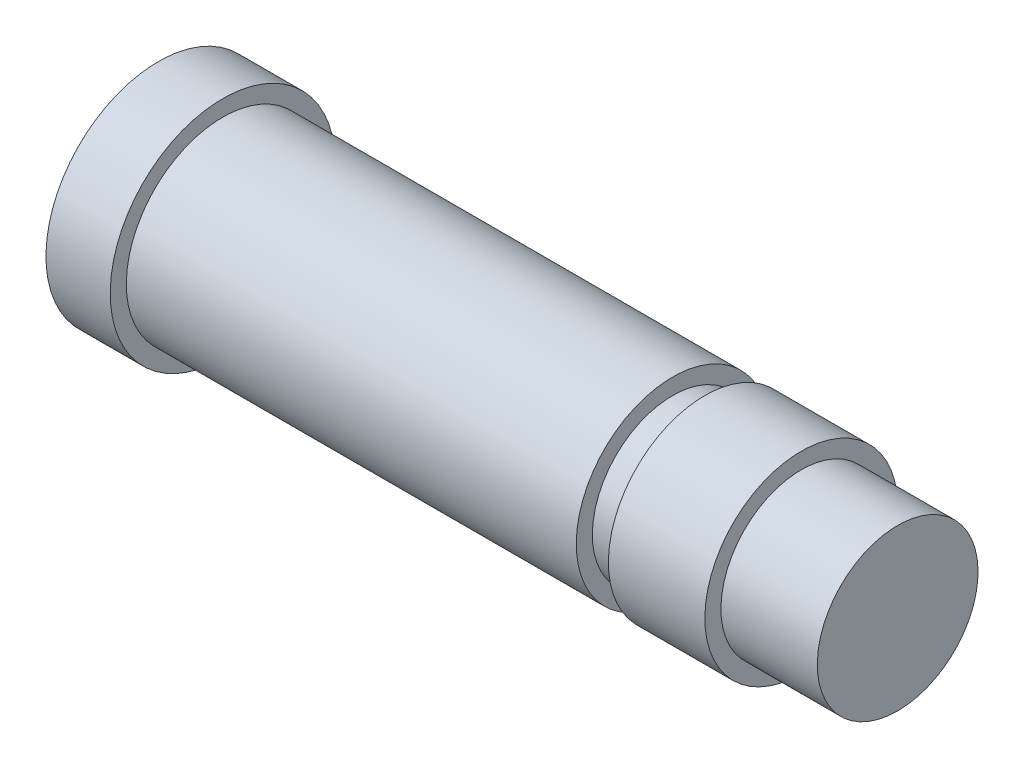
from build123d import *


with BuildPart() as part:
    # Sketch1 → Revolve1 (revolve)
    with BuildSketch(Plane.XY, mode=Mode.PRIVATE) as revolve1_sk:
        Polygon((0, 0), (40, 0), (46, 0), (46, 5), (40, 5), (40, 6), (34, 6), (34, 5), (32, 5), (32, 6), (4, 6), (4, 7), (0, 7), align=None)
    revolve(revolve1_sk.sketch.rotate(Axis((0, 0, 0), (1, 0, 0)), 180), axis=Axis((0, 0, 0), (1, 0, 0)))


solid = part.part
